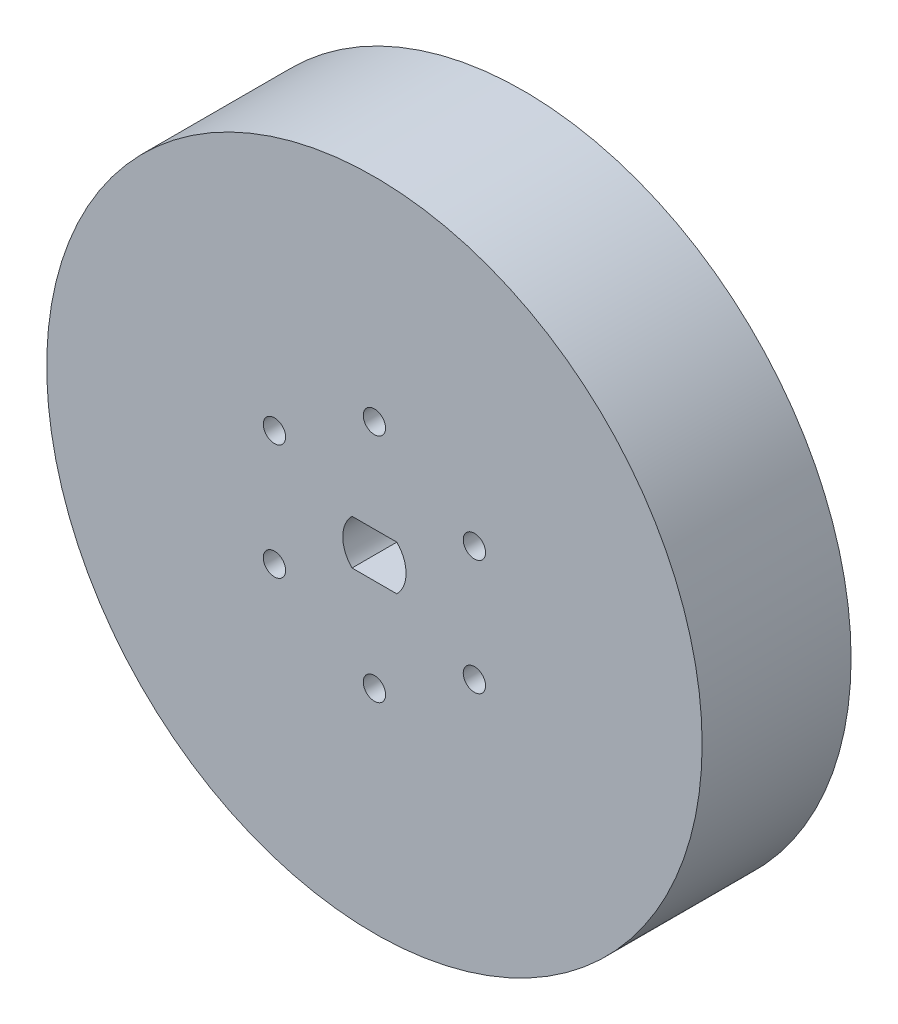
from build123d import *

# Parameters (mm, degrees)
SKETCH1_R           = 44
BOSS_EXTRUDE1_DEPTH = 20
SKETCH2_R           = 1.5
CUT_EXTRUDE1_DEPTH  = 114.02795241
SKETCH2_3_R         = 3
CUT_EXTRUDE2_DEPTH  = 3
CIRPATTERN1_COUNT   = 6


with BuildPart() as part:
    # Sketch1 → Boss-Extrude1 (new body)
    with BuildSketch(Plane.XY):
        with Locations((-42.570496177, 25.863203603)):
            Circle(SKETCH1_R)
        with BuildLine():
            Line((-39.565292357, 22.857999783), (-45.575699997, 22.857999783))
            ThreePointArc((-45.575699997, 22.857999783), (-46.820496177, 25.863203603), (-45.575699997, 28.868407423))
            Line((-45.575699997, 28.868407423), (-39.565292357, 28.868407423))
            ThreePointArc((-39.565292357, 28.868407423), (-38.320496177, 25.863203603), (-39.565292357, 22.857999783))
        make_face(mode=Mode.SUBTRACT)
    extrude(amount=BOSS_EXTRUDE1_DEPTH)

    # Sketch2 → Cut-Extrude1 (cut, through all)
    with BuildSketch(Plane(origin=(0, 0, 0), x_dir=(-1, 0, 0), z_dir=(0, 0, -1))):
        with Locations((42.570496177, 41.363203603)):
            Circle(SKETCH2_R)
    cut_extrude1 = extrude(amount=-CUT_EXTRUDE1_DEPTH, mode=Mode.SUBTRACT)

    # Sketch2<3> → Cut-Extrude2 (cut)
    with BuildSketch(Plane(origin=(0, 0, 0), x_dir=(-1, 0, 0), z_dir=(0, 0, -1))):
        with Locations((42.570496177, 41.363203603)):
            Circle(SKETCH2_3_R)
    cut_extrude2 = extrude(amount=-CUT_EXTRUDE2_DEPTH, mode=Mode.SUBTRACT)

    # CirPattern1: Cut-Extrude1, Cut-Extrude2 ×6 about axis
    cirpattern1_axis = Axis((-42.570496177, 25.863203603, 20), (0, 0, 1))
    add([cut_extrude1.rotate(cirpattern1_axis, i * 360 / CIRPATTERN1_COUNT) for i in range(1, CIRPATTERN1_COUNT)], mode=Mode.SUBTRACT)
    add([cut_extrude2.rotate(cirpattern1_axis, i * 360 / CIRPATTERN1_COUNT) for i in range(1, CIRPATTERN1_COUNT)], mode=Mode.SUBTRACT)


solid = part.part
